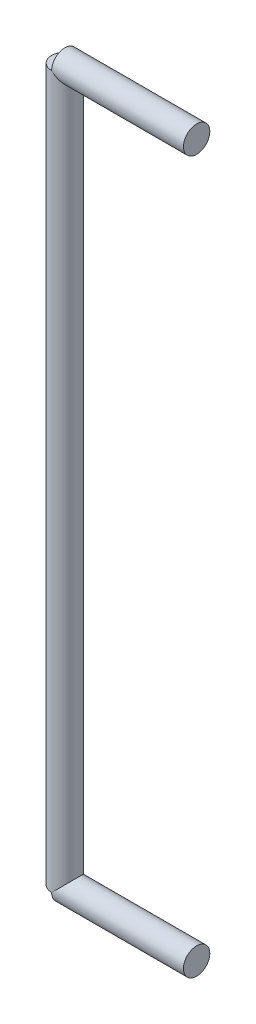
from build123d import *

# Parameters (mm, degrees)
SKETCH1_R           = 0.5
BOSS_EXTRUDE2_DEPTH = 27
SKETCH9_R           = 0.5
BOSS_EXTRUDE3_DEPTH = 5


with BuildPart() as part:
    # Sketch1 → Boss-Extrude2 (new body)
    with BuildSketch(Plane(origin=(0, 0, 0), x_dir=(1, 0, 0), z_dir=(0, 1, 0))):
        with Locations(Location((0, 0, 0), (0, 0, 270))):
            Circle(SKETCH1_R)
    extrude(amount=BOSS_EXTRUDE2_DEPTH)

    # Sketch9 → Boss-Extrude3 (add)
    with BuildSketch(Plane(origin=(0, 0, 0), x_dir=(0, 0, -1), z_dir=(1, 0, 0))):
        Circle(SKETCH9_R)
        with Locations((0, 27)):
            Circle(SKETCH9_R)
    extrude(amount=BOSS_EXTRUDE3_DEPTH)


solid = part.part
